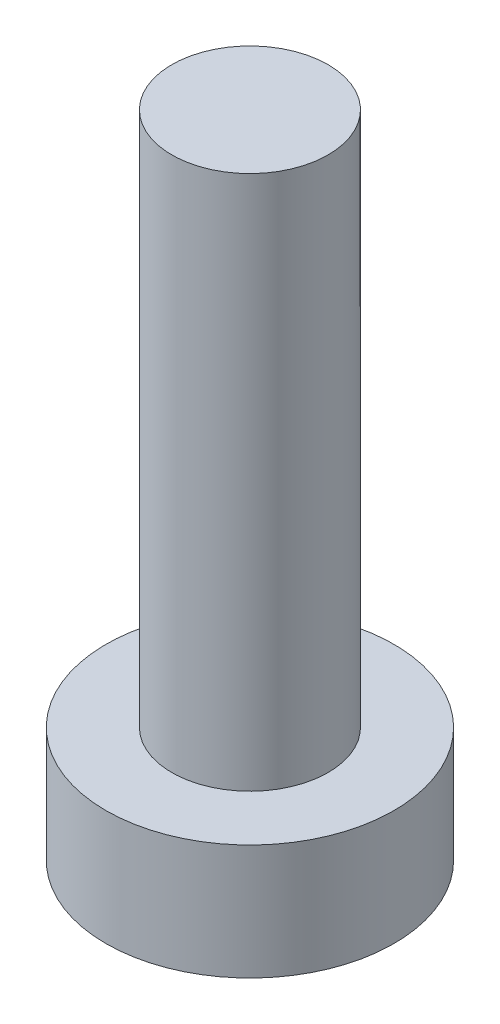
from build123d import *

# Parameters (mm, degrees)
SKETCH2_R           = 3.5
BOSS_EXTRUDE1_DEPTH = 2.8
SKETCH3_R           = 1.9
BOSS_EXTRUDE2_DEPTH = 13
CUT_EXTRUDE1_DEPTH  = 2.3


with BuildPart() as part:
    # Sketch2 → Boss-Extrude1 (new body)
    with BuildSketch(Plane(origin=(0, 0, 0), x_dir=(1, 0, 0), z_dir=(0, 1, 0))):
        with Locations(Location((0, 0, 0), (0, 0, 270))):
            Circle(SKETCH2_R)
    extrude(amount=BOSS_EXTRUDE1_DEPTH)

    # Sketch3 → Boss-Extrude2 (add)
    with BuildSketch(Plane(origin=(0, 2.8, 0), x_dir=(1, 0, 0), z_dir=(0, 1, 0))):
        with Locations(Location((0, 0, 0), (0, 0, 90))):
            Circle(SKETCH3_R)
    extrude(amount=BOSS_EXTRUDE2_DEPTH)

    # Sketch4 → Cut-Extrude1 (cut)
    with BuildSketch(Plane.XZ):
        Polygon((1.443375673, 0), (0.721687836, 1.25), (-0.721687836, 1.25), (-1.443375673, 0), (-0.721687836, -1.25), (0.721687836, -1.25), align=None)
    extrude(amount=-CUT_EXTRUDE1_DEPTH, mode=Mode.SUBTRACT)


solid = part.part
